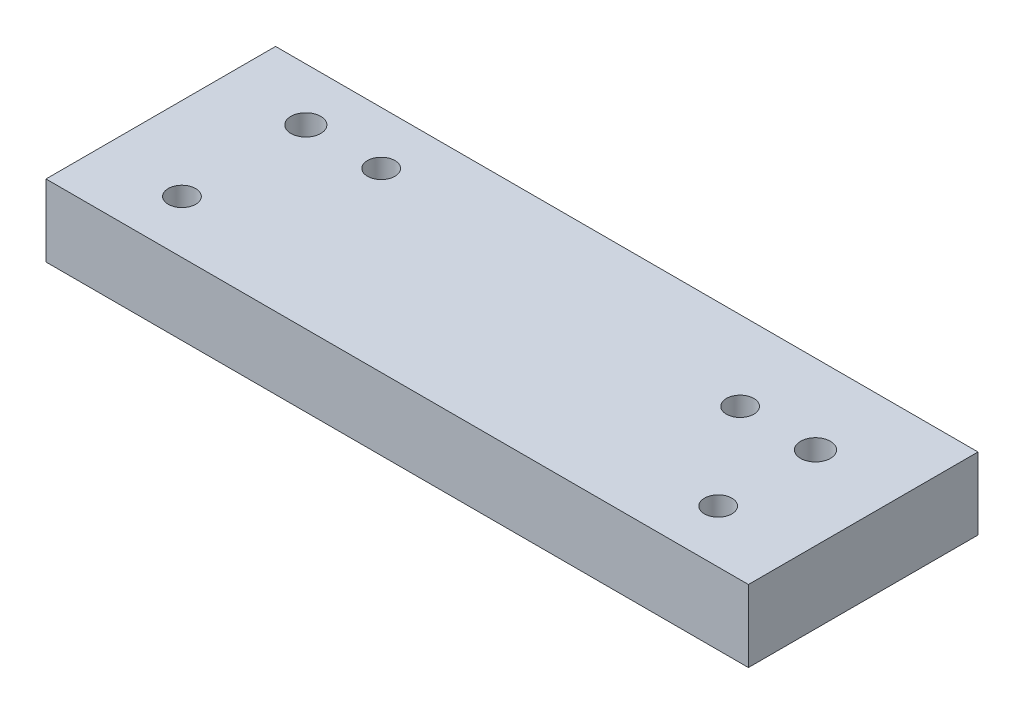
from build123d import *

# Parameters (mm, degrees)
SKETCH1_W           = 205
SKETCH1_H           = 67
BOSS_EXTRUDE1_DEPTH = 21
SKETCH2_R           = 4.35
SKETCH2_R_2         = 4
CUT_EXTRUDE1_DEPTH  = 21


with BuildPart() as part:
    # Sketch1 → Boss-Extrude1 (new body)
    with BuildSketch(Plane(origin=(0, 0, 0), x_dir=(1, 0, 0), z_dir=(0, 1, 0))):
        Rectangle(SKETCH1_W, SKETCH1_H)
    extrude(amount=BOSS_EXTRUDE1_DEPTH)

    # Sketch2 → Cut-Extrude1 (cut)
    with BuildSketch(Plane(origin=(0, 0, -21), x_dir=(1, 0, 0), z_dir=(0, -1, 0))):
        with Locations(Location((-78.25, 2.925, 0), (0, 0, 270))):
            Circle(SKETCH2_R)
        with Locations(Location((78.25, 10.675, 0), (0, 0, 270))):
            Circle(SKETCH2_R)
        with Locations(Location((-56.25, 2.925, 0), (0, 0, 270))):
            Circle(SKETCH2_R_2)
        with Locations(Location((56.25, 10.675, 0), (0, 0, 270))):
            Circle(SKETCH2_R_2)
        with Locations(Location((78.25, 39.075, 0), (0, 0, 270))):
            Circle(SKETCH2_R_2)
        with Locations(Location((-78.25, 39.075, 0), (0, 0, 270))):
            Circle(SKETCH2_R_2)
    extrude(amount=-CUT_EXTRUDE1_DEPTH, mode=Mode.SUBTRACT)


solid = part.part
